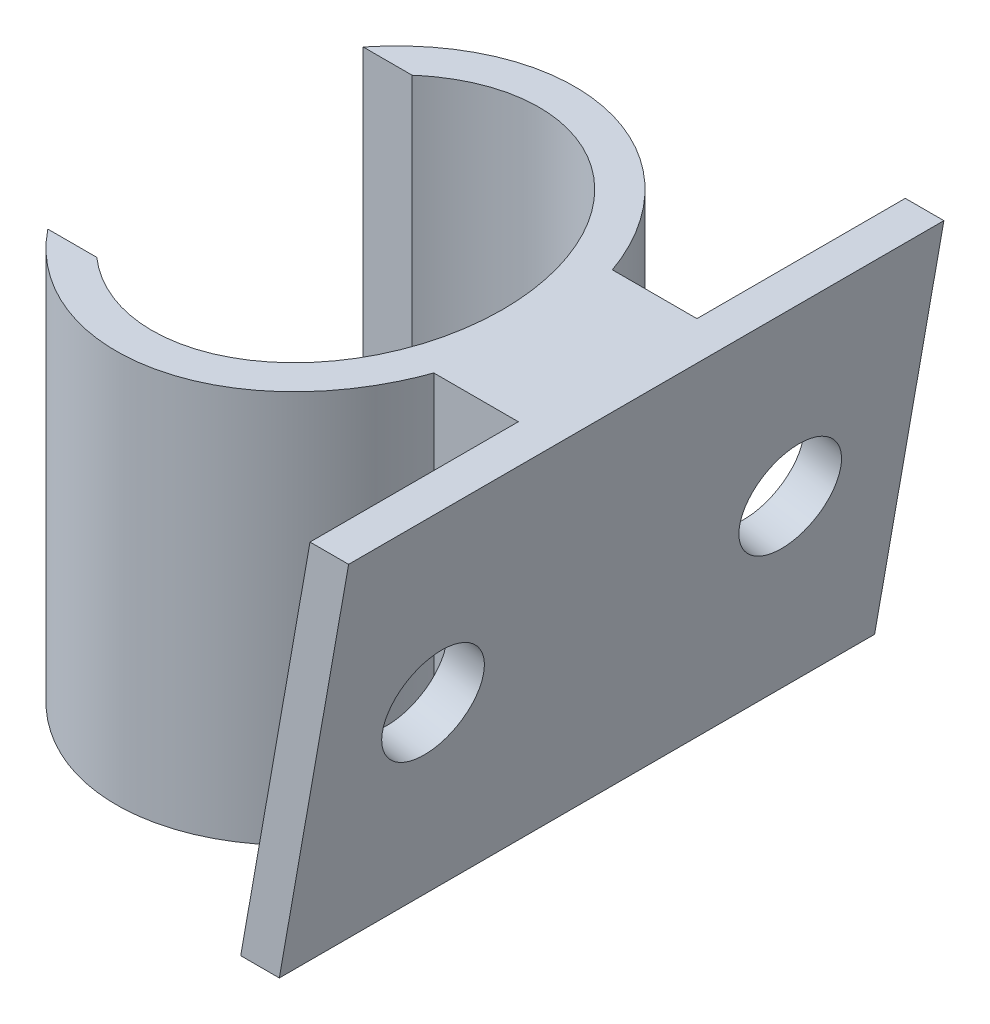
from build123d import *

# Parameters (mm, degrees)
CROQUIS1_RX                  = 19.25
CROQUIS1_RY                  = 16.2
CROQUIS1_RX_2                = 16.25
CROQUIS1_RY_2                = 13.2
SALIENTE_EXTRUIR1_DEPTH      = 33
CORTAR_EXTRUIR1_DEPTH        = 33
SALIENTE_EXTRUIR2_DEPTH      = 30
SALIENTE_EXTRUIR2_DEPTH_BACK = 30
CROQUIS4_W                   = 5.818790363
CROQUIS4_H                   = 5
CORTAR_EXTRUIR2_DEPTH        = 36
SALIENTE_EXTRUIR4_DEPTH      = 33
SALIENTE_EXTRUIR5_DEPTH      = 50
CORTAR_EXTRUIR3_DEPTH        = 50
CORTAR_EXTRUIR4_START        = -17.5
CORTAR_EXTRUIR4_DEPTH        = 17.5
CORTAR_EXTRUIR5_START        = -17.5
CORTAR_EXTRUIR5_DEPTH        = 17.5
CROQUIS11_R                  = 4.25
CORTAR_EXTRUIR6_DEPTH        = 4


with BuildPart() as part:
    # Croquis1 → Saliente-Extruir1 (new body)
    with BuildSketch(Plane(origin=(0, 0, 0), x_dir=(1, 0, 0), z_dir=(0, 1, 0))):
        with Locations(Location((0, 0), (0, 0, -90))):
            Ellipse(CROQUIS1_RX, CROQUIS1_RY)
        with Locations(Location((0, 0), (0, 0, -90))):
            Ellipse(CROQUIS1_RX_2, CROQUIS1_RY_2, mode=Mode.SUBTRACT)
    extrude(amount=SALIENTE_EXTRUIR1_DEPTH)

    # Croquis2 → Cortar-Extruir1 (cut)
    with BuildSketch(Plane(origin=(0, 33, 0), x_dir=(1, 0, 0), z_dir=(0, 1, 0))):
        Polygon((0, 0), (-7.647156017, 13.245262755), (-17.669144049, 13.245262755), (-24.728519105, -10.297452091), (-13.467362336, -13.245262755), (-7.647156017, -13.245262755), align=None)
    extrude(amount=-CORTAR_EXTRUIR1_DEPTH, mode=Mode.SUBTRACT)



with BuildPart() as body_2:
    # Croquis3 → Saliente-Extruir2 (new, two sides: drawn at the far end of the back side and taken through both)
    with BuildSketch(Plane.XY.offset(-SALIENTE_EXTRUIR2_DEPTH_BACK)):
        Polygon((16.2, 0), (22.018790363, 33), (16.2, 33), align=None)
    extrude(amount=SALIENTE_EXTRUIR2_DEPTH + SALIENTE_EXTRUIR2_DEPTH_BACK)

    # Croquis4 → Cortar-Extruir2 (cut)
    with BuildSketch(Plane(origin=(0, 33, 0), x_dir=(1, 0, 0), z_dir=(0, 1, 0))):
        with Locations((19.109395181, 27.5)):
            Rectangle(CROQUIS4_W, CROQUIS4_H)
        with Locations((19.109395181, -27.5)):
            Rectangle(CROQUIS4_W, CROQUIS4_H)
    extrude(amount=-CORTAR_EXTRUIR2_DEPTH, mode=Mode.SUBTRACT)


with BuildPart() as part_1:
    add(part.part)

    add(body_2.part)  # Saliente-Extruir4 merges body 2
    # Croquis5 → Saliente-Extruir4 (add)
    with BuildSketch(Plane(origin=(0, 33, 0), x_dir=(1, 0, 0), z_dir=(0, 1, 0))):
        Polygon((17.818457755, 0), (17.818457755, 7.5), (13.626292681, 7.5), (13.626292681, -7.5), (17.818457755, -7.5), align=None)
    extrude(amount=-SALIENTE_EXTRUIR4_DEPTH)

    # Croquis6 → Saliente-Extruir5 (add)
    with BuildSketch(Plane(origin=(0, 0, -25), x_dir=(-1, 0, 0), z_dir=(0, 0, -1))):
        Polygon((-22.018790363, 33), (-16.2, 0), (-19.345508023, -0.554637933), (-25.072873954, 31.926868346), (-25.262096019, 33), align=None)
    extrude(amount=-SALIENTE_EXTRUIR5_DEPTH)

    # Croquis7 → Cortar-Extruir3 (cut)
    with BuildSketch(Plane.XY.offset(25)):
        Polygon((16.2, 0), (19.443305655, 0), (19.345508023, -0.554637933), align=None)
    extrude(amount=-CORTAR_EXTRUIR3_DEPTH, mode=Mode.SUBTRACT)

    # Croquis8 → Cortar-Extruir4 (cut)
    with BuildSketch(Plane.XY.offset(25).offset(CORTAR_EXTRUIR4_START)):
        Polygon((16.2, 0), (22.018790363, 33), (16.2, 33), align=None)
    extrude(amount=CORTAR_EXTRUIR4_DEPTH, mode=Mode.SUBTRACT)

    # Croquis9 → Cortar-Extruir5 (cut)
    with BuildSketch(Plane(origin=(0, 0, -25), x_dir=(-1, 0, 0), z_dir=(0, 0, -1)).offset(CORTAR_EXTRUIR5_START)):
        Polygon((-16.2, 0), (-22.018790363, 33), (-16.2, 33), align=None)
    extrude(amount=CORTAR_EXTRUIR5_DEPTH, mode=Mode.SUBTRACT)

    # Croquis11 → Cortar-Extruir6 (cut)
    with BuildSketch(Plane(origin=(18.857018252, -3.325001094, 0), x_dir=(0, 0, -1), z_dir=(0.984807753012208, -0.17364817766693103, 0))):
        with Locations(Location((-15, 20.130372787, 0), (0, 0, 90))):
            Circle(CROQUIS11_R)
        with Locations(Location((15, 20.130372787, 0), (0, 0, 90))):
            Circle(CROQUIS11_R)
    extrude(amount=-CORTAR_EXTRUIR6_DEPTH, mode=Mode.SUBTRACT)


solid = part_1.part
